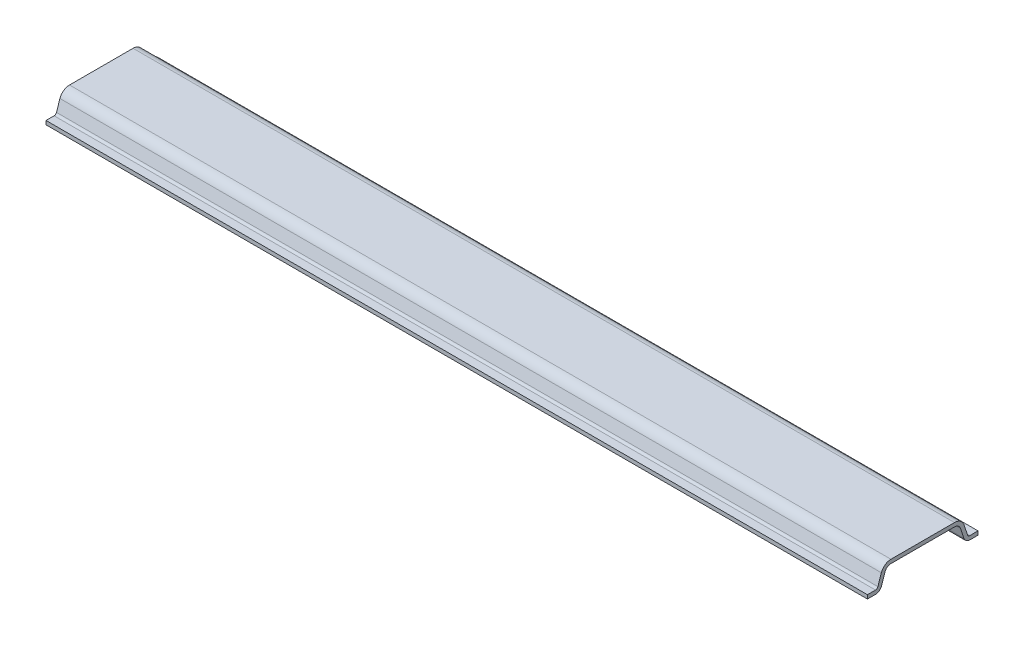
from build123d import *

# Parameters (mm, degrees)
EXTRUDE_1_DEPTH = 130


with BuildPart() as part:
    # 草图1 → 凸台-拉伸1 (new, symmetric)
    with BuildSketch(Plane(origin=(0, 0, 0), x_dir=(0, 0, -1), z_dir=(1, 0, 0))):
        with BuildLine():
            Line((17.5, 0), (14.94151844, 0))
            ThreePointArc((14.94151844, 0), (13.772097871, 0.37751563), (13.044151844, 1.367544468))
            Line((13.044151844, 1.367544468), (11.955848156, 4.632455532))
            ThreePointArc((11.955848156, 4.632455532), (11.227902129, 5.62248437), (10.05848156, 6))
            Line((10.05848156, 6), (-10.05848156, 6))
            ThreePointArc((-10.05848156, 6), (-11.227902129, 5.62248437), (-11.955848156, 4.632455532))
            Line((-11.955848156, 4.632455532), (-13.044151844, 1.367544468))
            ThreePointArc((-13.044151844, 1.367544468), (-13.772097871, 0.37751563), (-14.94151844, 0))
            Line((-14.94151844, 0), (-17.5, 0))
            Line((-17.5, 0), (-17.5, 1.2))
            Line((-17.5, 1.2), (-14.94151844, 1.2))
            ThreePointArc((-14.94151844, 1.2), (-14.473750212, 1.351006252), (-14.182571802, 1.747017787))
            Line((-14.182571802, 1.747017787), (-13.094268114, 5.011928851))
            ThreePointArc((-13.094268114, 5.011928851), (-11.929554471, 6.595974993), (-10.05848156, 7.2))
            Line((-10.05848156, 7.2), (10.05848156, 7.2))
            ThreePointArc((10.05848156, 7.2), (11.929554471, 6.595974993), (13.094268114, 5.011928851))
            Line((13.094268114, 5.011928851), (14.182571802, 1.747017787))
            ThreePointArc((14.182571802, 1.747017787), (14.473750212, 1.351006252), (14.94151844, 1.2))
            Line((14.94151844, 1.2), (17.5, 1.2))
            Line((17.5, 1.2), (17.5, 0))
        make_face()
    extrude(amount=EXTRUDE_1_DEPTH, both=True)


solid = part.part
